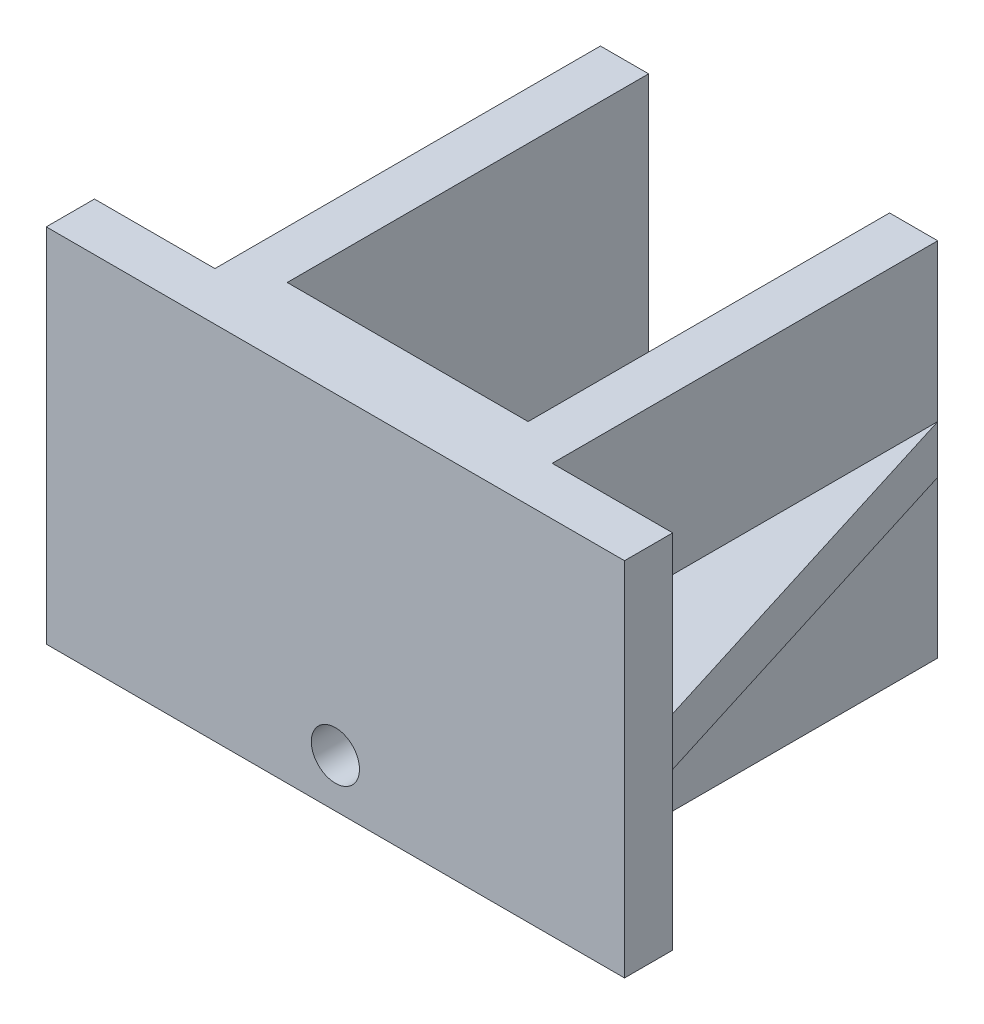
from build123d import *

# Parameters (mm, degrees)
BOSS_EXTRUDE1_DEPTH = 15
BOSS_EXTRUDE2_DEPTH = 2
SKETCH3_R           = 2
CUT_EXTRUDE1_DEPTH  = 42.243181255


with BuildPart() as part:
    # Sketch1 → Boss-Extrude1 (new, symmetric)
    with BuildSketch(Plane(origin=(0, 0, 0), x_dir=(1, 0, 0), z_dir=(0, 1, 0))):
        Polygon((10, 0), (-10, 0), (-10, 30), (-14, 30), (-14, -2), (-24, -2), (-24, -6), (24, -6), (24, -2), (14, -2), (14, 30), (10, 30), align=None)
    extrude(amount=BOSS_EXTRUDE1_DEPTH, both=True)

    # Sketch2 → Boss-Extrude2 (add, symmetric)
    with BuildSketch(Plane(origin=(0, 0, 0), x_dir=(1, 0, 0), z_dir=(0, 1, 0))):
        Polygon((14, 30), (14, -2), (24, -2), align=None)
    boss_extrude2 = extrude(amount=BOSS_EXTRUDE2_DEPTH, both=True)

    # Mirror1: Boss-Extrude2 across plane
    add(boss_extrude2.mirror(Plane(origin=(0, 0, 0), x_dir=(0, 0, 1), z_dir=(1, 0, 0))))

    # Sketch3 → Cut-Extrude1 (cut, through all)
    with BuildSketch(Plane(origin=(0, 0, 0), x_dir=(-1, 0, 0), z_dir=(0, 0, -1))):
        with Locations((0, -11)):
            Circle(SKETCH3_R)
    extrude(amount=-CUT_EXTRUDE1_DEPTH, mode=Mode.SUBTRACT)


solid = part.part
